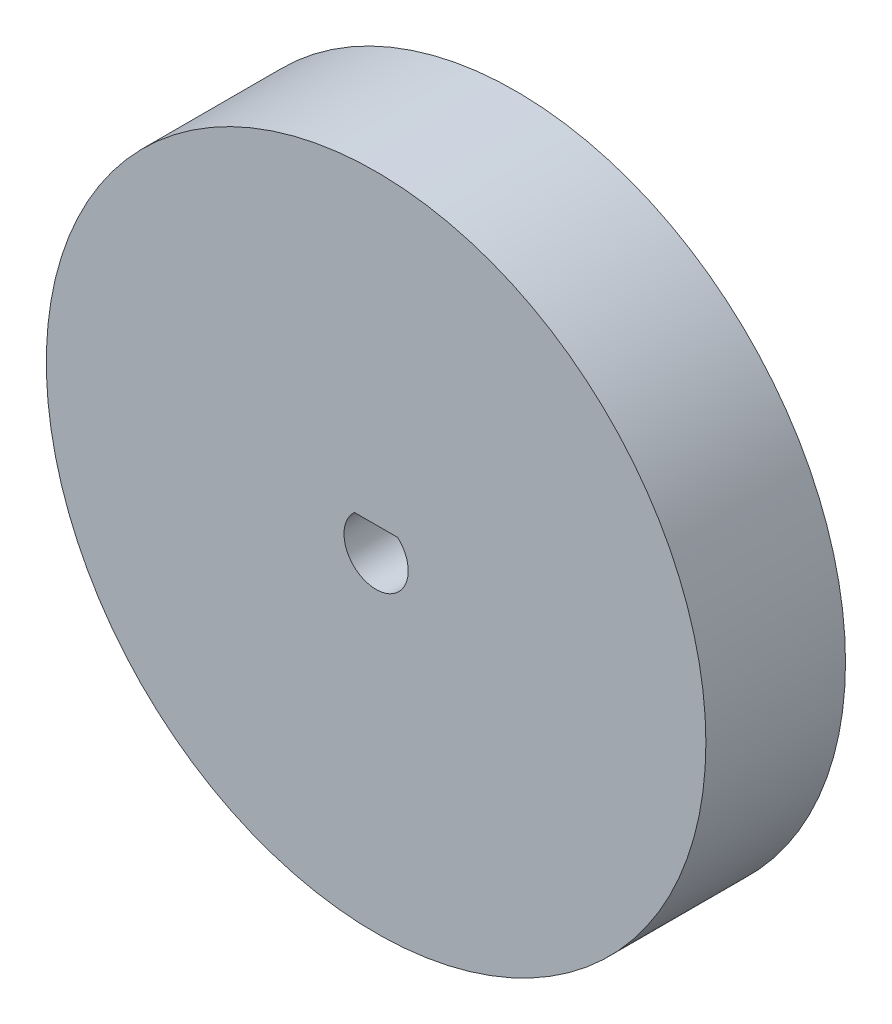
from build123d import *

# Parameters (mm, degrees)
SKETCH1_R           = 29.999999944
BOSS_EXTRUDE1_DEPTH = 12.7
CUT_EXTRUDE1_DEPTH  = 45.286453835


with BuildPart() as part:
    # Sketch1 → Boss-Extrude1 (new body)
    with BuildSketch(Plane.XY):
        Circle(SKETCH1_R)
    extrude(amount=BOSS_EXTRUDE1_DEPTH)

    # Sketch2 → Cut-Extrude1 (cut, through all)
    with BuildSketch(Plane(origin=(0, 0, 0), x_dir=(-1, 0, 0), z_dir=(0, 0, -1))):
        with BuildLine():
            ThreePointArc((1.96747554, 2.159), (0, -2.921), (-1.96747554, 2.159))
            Line((-1.96747554, 2.159), (1.96747554, 2.159))
        make_face()
    extrude(amount=-CUT_EXTRUDE1_DEPTH, mode=Mode.SUBTRACT)


solid = part.part
